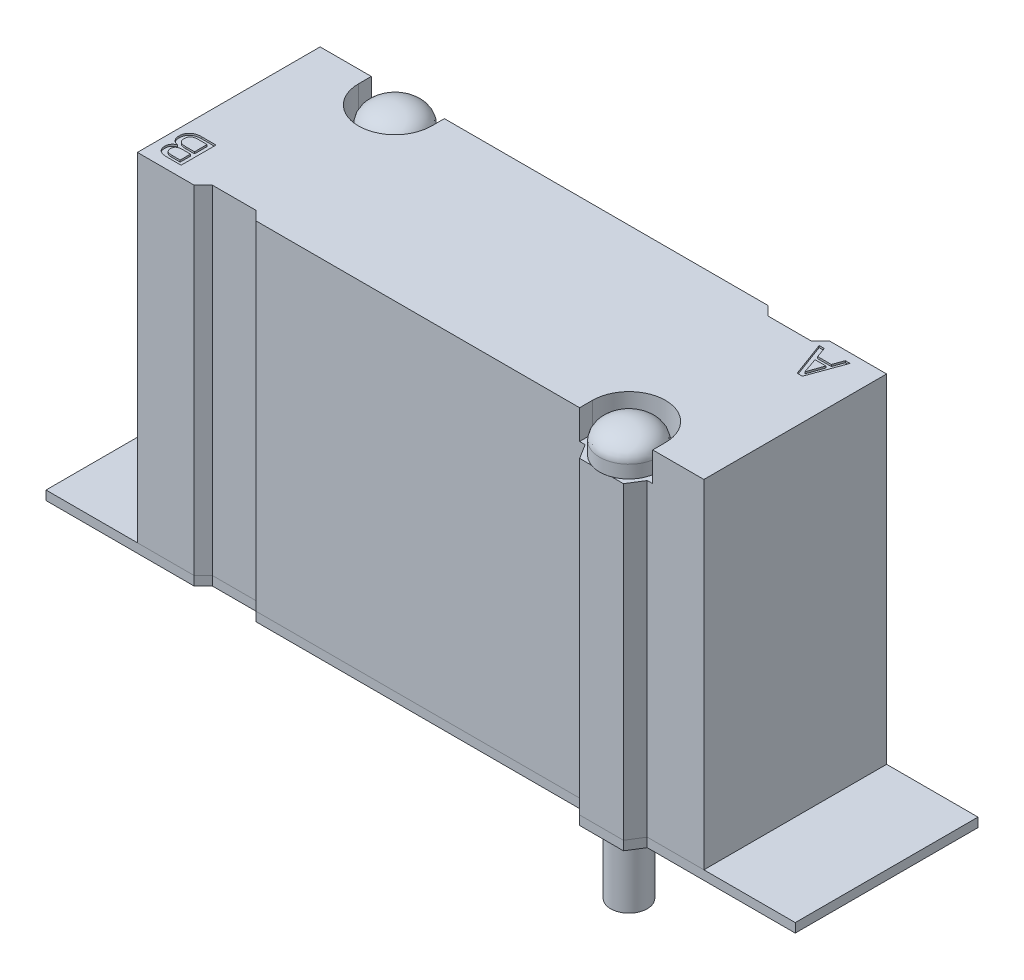
from build123d import *

# Parameters (mm, degrees)
BASE_SKETCH_W                 = 31
BASE_SKETCH_H                 = 11.6
VALVE_BASE_DEPTH              = 18.5
MOUNTING_SKETCH_R             = 1.1
MOUNTING_SCREW_HOLES_DEPTH    = 25.822167512
SIDE_CUTOUTS_DEPTH            = 25.822167512
CUT_EXTRUDE_A_DEPTH           = 0.1
CUT_EXTRUDE_B_DEPTH           = 0.1
SCREW_RELIEF_DEPTH            = 1.6
SCREW_HEAD_SKETCH_R           = 1.6
SCREW_HEAD_DEPTH              = 0.7
SCREW_HEAD_DOME_1_FACE_RADIUS = 1.6
SCREW_HEAD_DOME_1_HEIGHT      = 1
SCREW_HEAD_DOME_2_FACE_RADIUS = 1.6
SCREW_HEAD_DOME_2_HEIGHT      = 1
SCREW_THREADS_SKETCH_R        = 1
SCREW_THREADS_DEPTH           = 21
F_40_GASKET_SKETCH_R          = 1.1
F_40_GASKET_DEPTH             = 0.5


with BuildPart() as part:
    # Base Sketch → Valve base (new body)
    with BuildSketch(Plane(origin=(0, 0, 0), x_dir=(1, 0, 0), z_dir=(0, 1, 0))):
        Rectangle(BASE_SKETCH_W, BASE_SKETCH_H)
    extrude(amount=VALVE_BASE_DEPTH)

    # Mounting Sketch → Mounting Screw holes (cut, through all)
    with BuildSketch(Plane(origin=(0, 18.5, 0), x_dir=(-1, 0, 0), z_dir=(0, 1, 0))):
        with Locations(Location((-10.7, 4.3, 0), (0, 0, 90))):
            Circle(MOUNTING_SKETCH_R)
        with Locations(Location((10.7, -4.3, 0), (0, 0, 90))):
            Circle(MOUNTING_SKETCH_R)
    extrude(amount=-MOUNTING_SCREW_HOLES_DEPTH, mode=Mode.SUBTRACT)

    # side cut sketch → Side cutouts (cut, through all)
    with BuildSketch(Plane(origin=(0, 18.5, 0), x_dir=(-1, 0, 0), z_dir=(0, 1, 0))):
        Polygon((15.5, 5), (12.4, 5), (11.9, 4.5), (9.5, 4.5), (9, 5), (-9, 5), (-9.5, 5.8), (15.5, 5.8), align=None)
        Polygon((-11.9, 5.8), (-12.4, 5), (-15.5, 5), (-15.5, 5.8), align=None)
        Polygon((15.5, -5), (12.4, -5), (11.9, -5.8), (15.5, -5.8), align=None)
        Polygon((9.5, -5.8), (9, -5), (-9, -5), (-9.5, -4.5), (-11.9, -4.5), (-12.4, -5), (-15.5, -5), (-15.5, -5.8), align=None)
    extrude(amount=-SIDE_CUTOUTS_DEPTH, mode=Mode.SUBTRACT)

    # A Sketch → Cut-Extrude A (cut)
    with BuildSketch(Plane(origin=(0, 18.5, 0), x_dir=(-1, 0, 0), z_dir=(0, 1, 0))):
        Polygon((-14, -4.5), (-13.302127697, -2.587937137), (-13.016773764, -2.587937137), (-12.308559775, -4.5), (-12.588551352, -4.5), (-12.789639694, -3.936186592), (-13.538071352, -3.936186592), (-13.740691795, -4.5), align=None)
        Polygon((-13.45801904, -3.715563954), (-12.865861751, -3.715563954), (-13.160025269, -2.86409846), align=None, mode=Mode.SUBTRACT)
    extrude(amount=-CUT_EXTRUDE_A_DEPTH, mode=Mode.SUBTRACT)

    # B Sketch → Cut-Extrude B (cut)
    with BuildSketch(Plane(origin=(0, 18.5, 0), x_dir=(-1, 0, 0), z_dir=(0, 1, 0))):
        with BuildLine():
            Line((13.696109012, 2.5), (13.696109012, 4.412062863))
            Line((13.696109012, 4.412062863), (14.45449933, 4.412062863))
            add(Edge.make_bspline(
                [(14.45449933, 4.412062863), (14.478257852, 4.411688971), (14.524433142, 4.410962301), (14.591321129, 4.405553658), (14.653820092, 4.396962606), (14.711556909, 4.384359336), (14.764869843, 4.368460714), (14.813384507, 4.348348972), (14.857617281, 4.325229456), (14.897032572, 4.298168961), (14.931998423, 4.267779619), (14.961926966, 4.233278884), (14.987913656, 4.195700653), (15.00859288, 4.15422205), (15.024815372, 4.109370685), (15.036108382, 4.06090308), (15.043142564, 4.008943455), (15.043945593, 3.973139132), (15.044358466, 3.95473052)],
                knots=[0, 0, 0, 0, 1.338531614, 2.601470082, 3.778553788, 4.890456792, 5.928162005, 6.908738963, 7.84520586, 8.735147048, 9.596633689, 10.447968487, 11.301973765, 12.164180963, 13.051676454, 13.983434255, 14.963192844, 16, 16, 16, 16], degree=3))
            add(Edge.make_bspline(
                [(15.044358466, 3.95473052), (15.043453128, 3.931182499), (15.041696579, 3.88549433), (15.02874311, 3.81943049), (15.005850984, 3.759171327), (14.974543634, 3.704290685), (14.934165145, 3.655392946), (14.884583748, 3.613026669), (14.826645161, 3.576078243), (14.783324168, 3.557795778), (14.76091966, 3.548340556)],
                knots=[0, 0, 0, 0, 1.064089938, 2.064560856, 3.027045975, 3.965441717, 4.908263127, 5.877849772, 6.902478258, 8, 8, 8, 8], degree=3))
            add(Edge.make_bspline(
                [(14.76091966, 3.548340556), (14.775536857, 3.545402563), (14.804297843, 3.539621731), (14.845713362, 3.526727166), (14.884828242, 3.51152303), (14.921512767, 3.493568144), (14.955318682, 3.47224872), (14.986846804, 3.448563104), (15.01585291, 3.421881173), (15.042095036, 3.392380621), (15.066073253, 3.360709959), (15.086152481, 3.326449453), (15.103685874, 3.290549498), (15.11783739, 3.252432002), (15.128862246, 3.212171239), (15.136976428, 3.169929915), (15.141546807, 3.125710122), (15.142120645, 3.095614785), (15.142412972, 3.080283501)],
                knots=[0, 0, 0, 0, 1.079472139, 2.123983387, 3.137357801, 4.117691995, 5.07752268, 6.028353704, 6.970961659, 7.927265266, 8.885490285, 9.843581377, 10.799169054, 11.776706782, 12.784239396, 13.820032524, 14.889472473, 16, 16, 16, 16], degree=3))
            add(Edge.make_bspline(
                [(15.142412972, 3.080283501), (15.141980862, 3.058544612), (15.141138581, 3.016170572), (15.132163828, 2.954439411), (15.119238263, 2.896018184), (15.099837586, 2.841031835), (15.074777784, 2.789677413), (15.044848224, 2.741247391), (15.008885381, 2.69669958), (14.967904107, 2.65576764), (14.922300981, 2.618885875), (14.872256702, 2.58702628), (14.818235805, 2.560242438), (14.760653949, 2.537786365), (14.698817906, 2.521127273), (14.63323432, 2.509051166), (14.563731411, 2.501023848), (14.516061885, 2.500346722), (14.491652795, 2.5)],
                knots=[0, 0, 0, 0, 1.058427598, 2.063116183, 3.033417234, 3.969927738, 4.896405358, 5.812972495, 6.737861532, 7.679194237, 8.630321786, 9.589794139, 10.563499171, 11.563941868, 12.596215416, 13.678433312, 14.811246201, 16, 16, 16, 16], degree=3))
            Line((14.491652795, 2.5), (13.696109012, 2.5))
        make_face()
        with BuildLine():
            Line((13.965758903, 3.627626817), (14.401258797, 3.627626817))
            add(Edge.make_bspline(
                [(14.401258797, 3.627626817), (14.4167105, 3.627882087), (14.446623978, 3.628376273), (14.490028752, 3.631180774), (14.530289701, 3.637068538), (14.567395447, 3.644645892), (14.601449646, 3.653870957), (14.631871435, 3.666526162), (14.659642903, 3.680330492), (14.684077125, 3.697151785), (14.705689675, 3.715905827), (14.724440695, 3.737186773), (14.739596753, 3.761346258), (14.752935298, 3.7874564), (14.762770292, 3.816369594), (14.769522749, 3.847612765), (14.773836014, 3.88119858), (14.774410982, 3.904412728), (14.774708575, 3.916427978)],
                knots=[0, 0, 0, 0, 1.368886017, 2.65007316, 3.849640785, 4.969751217, 6.004381673, 6.968357812, 7.883879336, 8.746530739, 9.588092002, 10.41369514, 11.248159001, 12.107988605, 13.005734059, 13.944160956, 14.935932503, 16, 16, 16, 16], degree=3))
            add(Edge.make_bspline(
                [(14.774708575, 3.916427978), (14.774365013, 3.927799603), (14.773702887, 3.949715432), (14.770015709, 3.981585745), (14.763064505, 4.01108675), (14.753642898, 4.038420072), (14.7411212, 4.063294488), (14.726211444, 4.086036014), (14.708418737, 4.106498146), (14.687941733, 4.124646745), (14.664575078, 4.140448555), (14.638434372, 4.154338575), (14.609143216, 4.165574157), (14.577195917, 4.175336585), (14.5422697, 4.182314405), (14.504568738, 4.187804335), (14.463865084, 4.190719371), (14.435735067, 4.19119438), (14.421176119, 4.191440225)],
                knots=[0, 0, 0, 0, 1.064043854, 2.05066597, 2.995108535, 3.894129092, 4.74873584, 5.593437176, 6.431611697, 7.277662936, 8.145602371, 9.064553025, 10.040417484, 11.075719197, 12.186014413, 13.368359838, 14.637970495, 16, 16, 16, 16], degree=3))
            Line((14.421176119, 4.191440225), (13.965758903, 4.191440225))
            Line((13.965758903, 4.191440225), (13.965758903, 3.627626817))
        make_face(mode=Mode.SUBTRACT)
        with BuildLine():
            Line((13.965758903, 2.720622638), (14.469437321, 2.720622638))
            add(Edge.make_bspline(
                [(14.469437321, 2.720622638), (14.485535383, 2.720917677), (14.516640004, 2.721487751), (14.561798749, 2.725839449), (14.604000503, 2.732454325), (14.643180514, 2.742497536), (14.679549811, 2.755087486), (14.712861048, 2.770673575), (14.743053209, 2.789347324), (14.770551613, 2.810372914), (14.794619481, 2.834566767), (14.815584562, 2.861311147), (14.833263219, 2.890661087), (14.847862739, 2.922499214), (14.858953204, 2.956990744), (14.86689284, 2.993939419), (14.872042546, 3.033409922), (14.872518982, 3.060604908), (14.872763081, 3.07453812)],
                knots=[0, 0, 0, 0, 1.261340787, 2.437158505, 3.552412744, 4.605618057, 5.602418951, 6.564726798, 7.481099983, 8.379712099, 9.271165627, 10.147841252, 11.036708081, 11.950072001, 12.886651798, 13.869902527, 14.90865543, 16, 16, 16, 16], degree=3))
            add(Edge.make_bspline(
                [(14.872763081, 3.07453812), (14.872528231, 3.088345592), (14.872072093, 3.11516321), (14.866852376, 3.153979867), (14.859121902, 3.1901528), (14.847508303, 3.223263286), (14.832939865, 3.253616383), (14.814716207, 3.280902116), (14.793627219, 3.305758203), (14.768710027, 3.327365502), (14.740403211, 3.346137416), (14.708793141, 3.362814643), (14.673214268, 3.376356221), (14.634113921, 3.388075399), (14.590905202, 3.395988421), (14.544302015, 3.402686117), (14.493885398, 3.406472454), (14.459101523, 3.4068228), (14.44109344, 3.407004179)],
                knots=[0, 0, 0, 0, 1.058252033, 2.055394168, 2.998523969, 3.890395008, 4.739981298, 5.573732922, 6.40003374, 7.23274972, 8.093659094, 9.000297479, 9.967667442, 11.00874663, 12.12639854, 13.332554366, 14.619027337, 16, 16, 16, 16], degree=3))
            Line((14.44109344, 3.407004179), (13.965758903, 3.407004179))
            Line((13.965758903, 3.407004179), (13.965758903, 2.720622638))
        make_face(mode=Mode.SUBTRACT)
    extrude(amount=-CUT_EXTRUDE_B_DEPTH, mode=Mode.SUBTRACT)

    # Screw relief sketch → Screw relief (cut)
    with BuildSketch(Plane(origin=(0, 18.5, 0), x_dir=(-1, 0, 0), z_dir=(0, 1, 0))):
        with BuildLine():
            Line((8.7, -4.3), (8.7, -6.8))
            Line((8.7, -6.8), (12.7, -6.8))
            Line((12.7, -6.8), (12.7, -4.3))
            ThreePointArc((12.7, -4.3), (10.7, -2.3), (8.7, -4.3))
        make_face()
        with BuildLine():
            Line((-8.7, 4.3), (-8.7, 6.8))
            Line((-8.7, 6.8), (-12.7, 6.8))
            Line((-12.7, 6.8), (-12.7, 4.3))
            ThreePointArc((-12.7, 4.3), (-10.7, 2.3), (-8.7, 4.3))
        make_face()
    extrude(amount=-SCREW_RELIEF_DEPTH, mode=Mode.SUBTRACT)

    # Screw Head Sketch → Screw Head (add)
    with BuildSketch(Plane(origin=(0, 16.9, 0), x_dir=(-1, 0, 0), z_dir=(0, 1, 0))):
        with Locations(Location((-10.7, 4.3, 0), (0, 0, 69.635865194))):
            Circle(SCREW_HEAD_SKETCH_R)
        with Locations(Location((10.7, -4.3, 0), (0, 0, 290.364134806))):
            Circle(SCREW_HEAD_SKETCH_R)
    extrude(amount=SCREW_HEAD_DEPTH)

    # Screw Head Dome 1: an elliptical dome of height H over a round flat face of radius A is half a spheroid: the quarter ellipse of half axes A and H revolved about the face's axis
    with BuildSketch(Plane((-10.7, 17.6, -4.3), x_dir=(0, 0, -1), z_dir=(1, 0, 0)), mode=Mode.PRIVATE) as screw_head_dome_1_quarter:
        Ellipse(SCREW_HEAD_DOME_1_FACE_RADIUS, SCREW_HEAD_DOME_1_HEIGHT)
        Rectangle(SCREW_HEAD_DOME_1_FACE_RADIUS, SCREW_HEAD_DOME_1_HEIGHT, align=(Align.MIN, Align.MIN), mode=Mode.INTERSECT)
    revolve(screw_head_dome_1_quarter.sketch, axis=Axis((-10.7, 17.6, -4.3), (0, 1, 0)))

    # Screw Head Dome 2: an elliptical dome of height H over a round flat face of radius A is half a spheroid: the quarter ellipse of half axes A and H revolved about the face's axis
    with BuildSketch(Plane((10.7, 17.6, 4.3), x_dir=(0, 0, -1), z_dir=(1, 0, 0)), mode=Mode.PRIVATE) as screw_head_dome_2_quarter:
        Ellipse(SCREW_HEAD_DOME_2_FACE_RADIUS, SCREW_HEAD_DOME_2_HEIGHT)
        Rectangle(SCREW_HEAD_DOME_2_FACE_RADIUS, SCREW_HEAD_DOME_2_HEIGHT, align=(Align.MIN, Align.MIN), mode=Mode.INTERSECT)
    revolve(screw_head_dome_2_quarter.sketch, axis=Axis((10.7, 17.6, 4.3), (0, 1, 0)))

    # Screw Threads Sketch → Screw Threads (add)
    with BuildSketch(Plane.XZ.offset(-16.9)):
        with Locations(Location((10.7, 4.3, 0), (0, 0, 90))):
            Circle(SCREW_THREADS_SKETCH_R)
        with Locations(Location((-10.7, -4.3, 0), (0, 0, 90))):
            Circle(SCREW_THREADS_SKETCH_R)
    extrude(amount=SCREW_THREADS_DEPTH)


with BuildPart() as body_2:
    # 40 Gasket Sketch → 40 Gasket (new body)
    with BuildSketch(Plane.XZ):
        Polygon((20.5, 5), (20.5, -5), (12.4, -5), (11.9, -4.5), (9.5, -4.5), (9, -5), (-9, -5), (-9.5, -5.8), (-11.9, -5.8), (-12.4, -5), (-20.5, -5), (-20.5, 5), (-12.4, 5), (-11.9, 4.5), (-9.5, 4.5), (-9, 5), (9, 5), (9.5, 5.8), (11.9, 5.8), (12.4, 5), align=None)
        with Locations(Location((10.7, 4.3, 0), (0, 0, 270))):
            Circle(F_40_GASKET_SKETCH_R, mode=Mode.SUBTRACT)
        with Locations(Location((-10.7, -4.3, 0), (0, 0, 270))):
            Circle(F_40_GASKET_SKETCH_R, mode=Mode.SUBTRACT)
    extrude(amount=F_40_GASKET_DEPTH)


solid = Compound([part.part, body_2.part])
